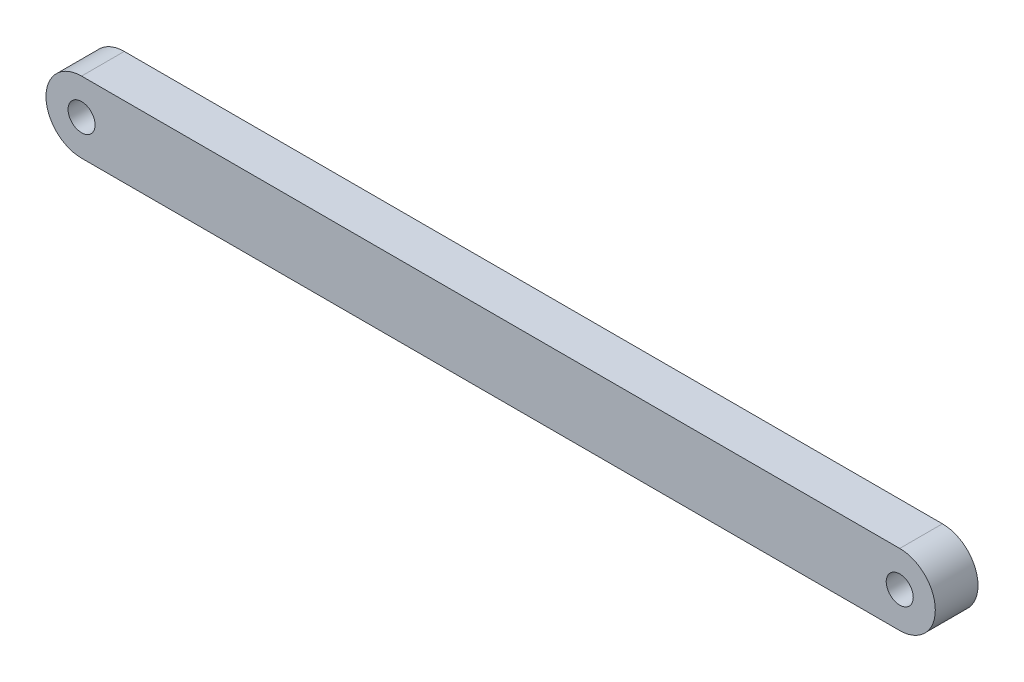
from build123d import *

# Parameters (mm, degrees)
SKETCH1_R           = 1.9
BOSS_EXTRUDE1_DEPTH = 6


with BuildPart() as part:
    # Sketch1 → Boss-Extrude1 (new body)
    with BuildSketch(Plane.XY):
        with BuildLine():
            Line((-57.5, 5), (57.5, 5))
            ThreePointArc((57.5, 5), (62.5, 0), (57.5, -5))
            Line((57.5, -5), (-57.5, -5))
            ThreePointArc((-57.5, -5), (-62.5, 0), (-57.5, 5))
        make_face()
        with Locations((-57.5, 0)):
            Circle(SKETCH1_R, mode=Mode.SUBTRACT)
        with Locations((57.5, 0)):
            Circle(SKETCH1_R, mode=Mode.SUBTRACT)
    extrude(amount=BOSS_EXTRUDE1_DEPTH)


solid = part.part
